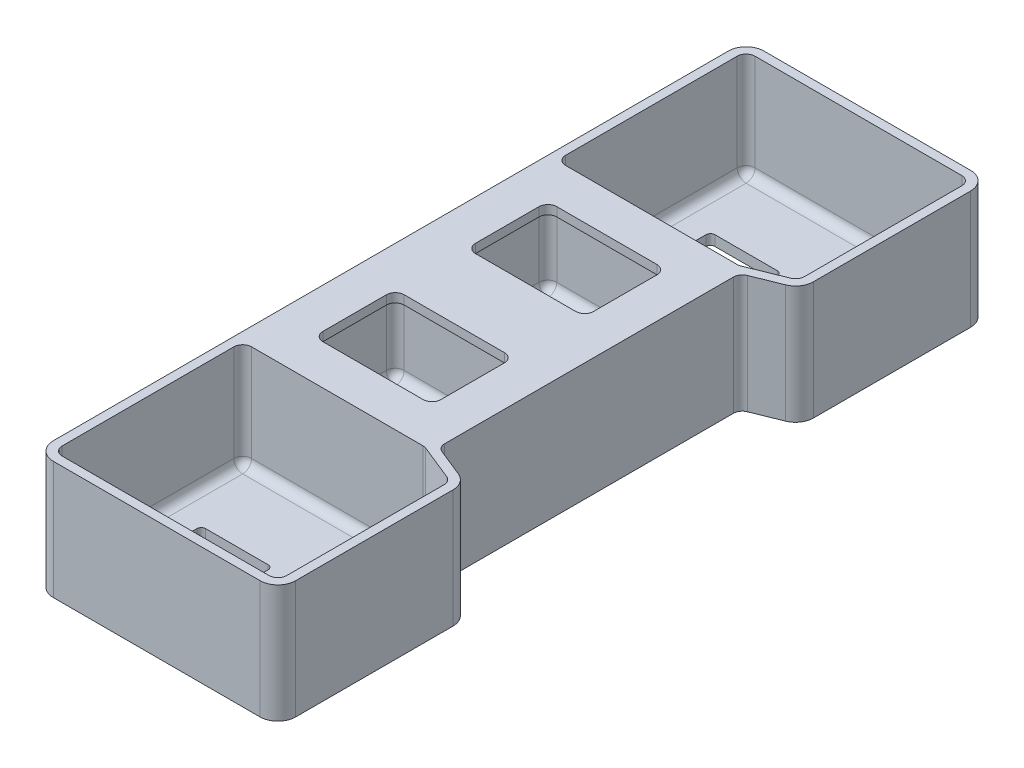
from build123d import *

# Parameters (mm, degrees)
EXTRUDE_1_DEPTH               = 265
EXTRUDE_2_REACH               = 1707.927
CUT_EXTRUDE_1_DEPTH           = 265
CUT_EXTRUDE_2_DEPTH           = 23
SKETCH_5_R                    = 77.00000000000003
CUT_EXTRUDE_3_DEPTH           = 3
SKETCH_6_R                    = 77.00000000000003
CUT_EXTRUDE_4_DEPTH           = 23
EXTRUDE_3_REACH               = 1301.485
SKETCH_7_W                    = 428.7372673266602
SKETCH_7_H                    = 19.99999999999997
CUT_EXTRUDE_5_DEPTH           = 20
HOLE_WIZARD_M10_1_D           = 8.5
HOLE_WIZARD_M10_1_DEPTH       = 20
HOLE_WIZARD_M10_1_CSINK_D     = 10.05
HOLE_WIZARD_M10_1_CSINK_ANGLE = 90
HOLE_WIZARD_M10_1_TIP         = 2.5536576308671313
CUT_EXTRUDE_6_DEPTH           = 705
FILLET_1_R                    = 20
FILLET_2_R                    = 40
FILLET_3_R                    = 20
FILLET_4_R                    = 40
FILLET_5_R                    = 20
FILLET_6_R                    = 20
FILLET_7_R                    = 20
FILLET_8_R                    = 20


with BuildPart() as part:
    # 草图1 → 凸台-拉伸1 (new body)
    with BuildSketch(Plane(origin=(0, 0, 0), x_dir=(1, 0, 0), z_dir=(0, 1, 0))):
        Polygon((0, -797.5000000000001), (0, 797.5000000000001), (544, 797.5000000000001), (544.0000000000001, 377.5000000000001), (444.99999999999994, 337.49999999999994), (444.99999999999994, -337.49999999999994), (544.0000000000001, -377.5000000000001), (544, -797.5000000000001), align=None)
        Polygon((20.000000000000036, 10), (425, 10), (425, 332.4999999999999), (20.000000000000018, 332.49999999999983), align=None, mode=Mode.SUBTRACT)
        Polygon((20.000000000000018, 777.4999999999999), (20.000000000000053, 352.49999999999994), (428.7372673266602, 352.49999999999994), (524, 390.9899929993293), (524, 777.5000000000001), align=None, mode=Mode.SUBTRACT)
        Polygon((524, -777.5000000000001), (20.000000000000018, -777.4999999999999), (20.000000000000053, -352.49999999999994), (428.7372673266602, -352.49999999999994), (524, -390.9899929993293), align=None, mode=Mode.SUBTRACT)
        Polygon((20.000000000000018, -332.49999999999983), (20.000000000000036, -10), (425, -10), (425, -332.4999999999999), align=None, mode=Mode.SUBTRACT)
    extrude(amount=EXTRUDE_1_DEPTH)

    # 凸台-拉伸2: up to this face of the body (flat: up to its plane)
    extrude_2_end = Plane(part.part.faces().sort_by_distance((272, 132.5, 797.5))[0])
    # 草图2 → 凸台-拉伸2 (add, up to the picked face)
    with BuildSketch(Plane(origin=(0, 0, -797.5000000000001), x_dir=(-1, 0, 0), z_dir=(0, 0, -1)), mode=Mode.PRIVATE) as extrude_2_sk1:
        Polygon((-544, 27.999999999999943), (0, 27.999999999999936), (0, 5.000000000000004), (-544, 4.9999999999999485), align=None)
    extrude_2_tool1 = split(extrude(extrude_2_sk1.sketch, amount=-EXTRUDE_2_REACH, mode=Mode.PRIVATE), bisect_by=extrude_2_end, keep=Keep.BOTH, mode=Mode.PRIVATE)
    add(extrude_2_tool1.solids().sort_by(Axis((272, 16.5, -797.5), (0, 0, 1)))[0])

    # 草图3 → 切除-拉伸1 (cut)
    with BuildSketch(Plane(origin=(-3.6e-16, 27.999999999999936, 0), x_dir=(1, 1e-17, 0), z_dir=(-1e-17, 1, 0))):
        Polygon((544, -377.5000000000003), (544.0000000000001, 377.5000000000001), (444.99999999999994, 337.49999999999994), (444.99999999999994, -337.49999999999994), align=None)
    extrude(amount=-CUT_EXTRUDE_1_DEPTH, mode=Mode.SUBTRACT)

    # 草图4 → 切除-拉伸2 (cut)
    with BuildSketch(Plane(origin=(-3.6e-16, 27.999999999999936, 0), x_dir=(1, 1e-17, 0), z_dir=(-1e-17, 1, 0))):
        with BuildLine():
            Line((95.00000000000003, 612.4999999999999), (95.00000000000003, 530.5000000000002))
            ThreePointArc((95.00000000000003, 530.5000000000002), (97.92893218813454, 523.4289321881347), (105.0000000000001, 520.5000000000001))
            Line((105.0000000000001, 520.5000000000001), (244.99999999999994, 520.5000000000001))
            ThreePointArc((244.99999999999994, 520.5000000000001), (252.0710678118655, 523.4289321881347), (255, 530.5000000000002))
            Line((255, 530.5000000000002), (255, 612.4999999999999))
            ThreePointArc((255, 612.4999999999999), (252.0710678118655, 619.5710678118654), (244.99999999999994, 622.5))
            Line((244.99999999999994, 622.5), (105.0000000000001, 622.5))
            ThreePointArc((105.0000000000001, 622.5), (97.92893218813454, 619.5710678118654), (95.00000000000003, 612.4999999999999))
        make_face()
        with BuildLine():
            Line((95.00000000000003, -612.4999999999999), (95.00000000000003, -530.5000000000002))
            ThreePointArc((95.00000000000003, -530.5000000000002), (97.92893218813454, -523.4289321881347), (105.0000000000001, -520.5000000000001))
            Line((105.0000000000001, -520.5000000000001), (244.99999999999994, -520.5000000000001))
            ThreePointArc((244.99999999999994, -520.5000000000001), (252.0710678118655, -523.4289321881347), (255, -530.5000000000002))
            Line((255, -530.5000000000002), (255, -612.4999999999999))
            ThreePointArc((255, -612.4999999999999), (252.0710678118655, -619.5710678118654), (244.99999999999994, -622.5))
            Line((244.99999999999994, -622.5), (105.0000000000001, -622.5))
            ThreePointArc((105.0000000000001, -622.5), (97.92893218813454, -619.5710678118654), (95.00000000000003, -612.4999999999999))
        make_face()
    extrude(amount=-CUT_EXTRUDE_2_DEPTH, mode=Mode.SUBTRACT)

    # 草图5 → 切除-拉伸3 (cut)
    # profile 1 of 2: a face of its own
    with BuildSketch(Plane(origin=(-3.6e-16, 27.999999999999936, 0), x_dir=(1, 1e-17, 0), z_dir=(-1e-17, 1, 0))):
        with BuildLine():
            Line((292.00000000000006, 704.5000000000001), (292.00000000000006, 450.50000000000017))
            ThreePointArc((292.00000000000006, 450.50000000000017), (294.3431457505077, 444.84314575050774), (300.0000000000001, 442.5000000000001))
            Line((300.0000000000001, 442.5000000000001), (487.99999999999994, 442.5000000000001))
            ThreePointArc((487.99999999999994, 442.5000000000001), (493.65685424949237, 444.84314575050774), (496, 450.50000000000017))
            Line((496, 450.50000000000017), (496, 704.5000000000002))
            ThreePointArc((496, 704.5000000000002), (493.65685424949237, 710.1568542494927), (487.99999999999994, 712.5000000000002))
            Line((487.99999999999994, 712.5000000000002), (300.0000000000001, 712.5000000000001))
            ThreePointArc((300.0000000000001, 712.5000000000001), (294.3431457505077, 710.1568542494925), (292.00000000000006, 704.5000000000001))
        make_face()
        with Locations(Location((394, 577.5000000000001, 0), (0, 0, 180))):
            Circle(SKETCH_5_R, mode=Mode.SUBTRACT)
    # profile 2 of 2: a face of its own
    with BuildSketch(Plane(origin=(-3.6e-16, 27.999999999999936, 0), x_dir=(1, 1e-17, 0), z_dir=(-1e-17, 1, 0))):
        with BuildLine():
            Line((496, -450.50000000000017), (496, -704.5000000000002))
            ThreePointArc((496, -704.5000000000002), (493.65685424949237, -710.1568542494927), (487.99999999999994, -712.5000000000002))
            Line((487.99999999999994, -712.5000000000002), (300.0000000000001, -712.5000000000001))
            ThreePointArc((300.0000000000001, -712.5000000000001), (294.3431457505077, -710.1568542494925), (292.00000000000006, -704.5000000000001))
            Line((292.00000000000006, -704.5000000000001), (292.00000000000006, -450.50000000000017))
            ThreePointArc((292.00000000000006, -450.50000000000017), (294.3431457505077, -444.84314575050774), (300.0000000000001, -442.5000000000001))
            Line((300.0000000000001, -442.5000000000001), (487.99999999999994, -442.5000000000001))
            ThreePointArc((487.99999999999994, -442.5000000000001), (493.65685424949237, -444.84314575050774), (496, -450.50000000000017))
        make_face()
        with Locations((394, -577.5000000000001)):
            Circle(SKETCH_5_R, mode=Mode.SUBTRACT)
    extrude(amount=-CUT_EXTRUDE_3_DEPTH, mode=Mode.SUBTRACT)

    # 草图6 → 切除-拉伸4 (cut)
    with BuildSketch(Plane(origin=(-3.6e-16, 27.999999999999936, 0), x_dir=(1, 1e-17, 0), z_dir=(-1e-17, 1, 0))):
        with Locations(Location((394, 577.5000000000001, 0), (0, 0, 180))):
            Circle(SKETCH_6_R)
        with Locations(Location((394, -577.5000000000001, 0), (0, 0, 180))):
            Circle(SKETCH_6_R)
    extrude(amount=-CUT_EXTRUDE_4_DEPTH, mode=Mode.SUBTRACT)

    # 凸台-拉伸3: up to this face of the body (flat: up to its plane)
    extrude_3_end = Plane(part.part.faces().sort_by_distance((222.5, 146.5, 332.5))[0])
    # 草图7 → 凸台-拉伸3 (add, up to the picked face)
    with BuildSketch(Plane(origin=(0, 0, -352.49999999999994), x_dir=(-1, 0, 0), z_dir=(0, 0, -1)), mode=Mode.PRIVATE) as extrude_3_sk1:
        with Locations((-214.3686336633301, 255)):
            Rectangle(SKETCH_7_W, SKETCH_7_H)
    extrude_3_tool1 = split(extrude(extrude_3_sk1.sketch, amount=-EXTRUDE_3_REACH, mode=Mode.PRIVATE), bisect_by=extrude_3_end, keep=Keep.BOTH, mode=Mode.PRIVATE)
    add(extrude_3_tool1.solids().sort_by(Axis((214.368634, 255, -352.5), (0, 0, 1)))[0])

    # 草图8 → 切除-拉伸5 (cut)
    with BuildSketch(Plane(origin=(0, 265, 0), x_dir=(1, 0, 0), z_dir=(0, 1, 0))):
        with BuildLine():
            Line((90.00000000000003, 242.49999999999983), (90.00000000000007, 100.0000000000001))
            ThreePointArc((90.00000000000007, 100.0000000000001), (95.8578643762691, 85.857864376269), (110.00000000000021, 79.99999999999996))
            Line((110.00000000000021, 79.99999999999996), (334.99999999999983, 80.00000000000001))
            ThreePointArc((334.99999999999983, 80.00000000000001), (349.1421356237309, 85.85786437626908), (355, 100.00000000000014))
            Line((355, 100.00000000000014), (355.00000000000006, 242.49999999999986))
            ThreePointArc((355.00000000000006, 242.49999999999986), (349.14213562373095, 256.64213562373095), (334.9999999999999, 262.5))
            Line((334.9999999999999, 262.5), (110.00000000000017, 262.49999999999994))
            ThreePointArc((110.00000000000017, 262.49999999999994), (95.8578643762691, 256.6421356237309), (90.00000000000003, 242.49999999999983))
        make_face()
        with BuildLine():
            Line((355, -100.00000000000014), (355.00000000000006, -242.49999999999986))
            ThreePointArc((355.00000000000006, -242.49999999999986), (349.14213562373095, -256.64213562373095), (334.9999999999999, -262.5))
            Line((334.9999999999999, -262.5), (110.00000000000017, -262.49999999999994))
            ThreePointArc((110.00000000000017, -262.49999999999994), (95.8578643762691, -256.6421356237309), (90.00000000000003, -242.49999999999983))
            Line((90.00000000000003, -242.49999999999983), (90.00000000000007, -100.0000000000001))
            ThreePointArc((90.00000000000007, -100.0000000000001), (95.8578643762691, -85.857864376269), (110.00000000000021, -79.99999999999996))
            Line((110.00000000000021, -79.99999999999996), (334.99999999999983, -80.00000000000001))
            ThreePointArc((334.99999999999983, -80.00000000000001), (349.1421356237309, -85.85786437626908), (355, -100.00000000000014))
        make_face()
    extrude(amount=-CUT_EXTRUDE_5_DEPTH, mode=Mode.SUBTRACT)

    # M10 螺纹孔1
    with Locations(Plane(origin=(-3.2e-16, 24.999999999999936, 0), x_dir=(1, 1e-17, 0), z_dir=(-1e-17, 1, 0))):
        with Locations((314, -692.5), (474, 692.5), (314, 692.5), (474, 462.5), (314, 462.5), (314, -462.5), (474, -462.5), (474, -692.5)):
            CounterSinkHole(HOLE_WIZARD_M10_1_D / 2, HOLE_WIZARD_M10_1_CSINK_D / 2, depth=HOLE_WIZARD_M10_1_DEPTH, counter_sink_angle=HOLE_WIZARD_M10_1_CSINK_ANGLE)
            with Locations((0, 0, -(HOLE_WIZARD_M10_1_DEPTH + HOLE_WIZARD_M10_1_TIP / 2))):  # 118° drill point
                Cone(0, HOLE_WIZARD_M10_1_D / 2, HOLE_WIZARD_M10_1_TIP, mode=Mode.SUBTRACT)

    # 草图11 → 切除-拉伸6 (cut)
    with BuildSketch(Plane(origin=(0, 0, -352.49999999999994), x_dir=(-1, 0, 0), z_dir=(0, 0, -1))):
        Polygon((-20.000000000000053, 0), (-428.7372673266602, 0), (-428.7372673266602, 4.9999999999999485), (-20.000000000000053, 5.000000000000004), align=None)
    extrude(amount=-CUT_EXTRUDE_6_DEPTH, mode=Mode.SUBTRACT)

    # 圆角1
    fillet_1_edges = [part.edges().sort_by_distance(p)[0] for p in [
        (444.99999999999994, 132.5, -337.49999999999994),
        (524, 146.49999999999997, -777.5000000000001),
        (20.000000000000018, 146.49999999999997, -777.4999999999999),
        (20.000000000000053, 146.49999999999997, -352.49999999999994),
        (428.7372673266602, 146.49999999999997, -352.49999999999994),
        (524, 146.49999999999997, -390.9899929993293),
    ]]
    fillet(fillet_1_edges, radius=FILLET_1_R)

    # 圆角2
    fillet_2_edges = [part.edges().sort_by_distance(p)[0] for p in [
        (0, 132.5, -797.5000000000001),
        (544, 132.5, -797.5000000000001),
        (544.0000000000001, 132.5, -377.5000000000001),
    ]]
    fillet(fillet_2_edges, radius=FILLET_2_R)

    # 圆角3
    fillet_3_edges = [part.edges().sort_by_distance(p)[0] for p in [
        (444.99999999999994, 132.5, 337.49999999999994),
        (524, 146.49999999999997, 777.5000000000001),
        (524, 146.49999999999997, 390.9899929993293),
        (428.7372673266602, 146.49999999999997, 352.49999999999994),
        (20.000000000000053, 146.49999999999997, 352.49999999999994),
        (20.000000000000018, 146.49999999999997, 777.4999999999999),
    ]]
    fillet(fillet_3_edges, radius=FILLET_3_R)

    # 圆角4
    fillet_4_edges = [part.edges().sort_by_distance(p)[0] for p in [
        (544.0000000000001, 132.5, 377.5000000000001),
        (544, 132.5, 797.5000000000001),
        (0, 132.5, 797.5000000000001),
    ]]
    fillet(fillet_4_edges, radius=FILLET_4_R)

    # 圆角5
    fillet_5_edges = [part.edges().sort_by_distance(p)[0] for p in [
        (20.000000000000036, 136.49999999999997, 10),
        (20.000000000000018, 136.49999999999997, 332.49999999999983),
        (425, 136.5, 10),
        (425, 136.5, 332.4999999999999),
        (425, 136.5, -332.4999999999999),
        (20.000000000000018, 136.49999999999997, -332.49999999999983),
        (425, 136.5, -10),
        (20.000000000000036, 136.49999999999997, -10),
    ]]
    fillet(fillet_5_edges, radius=FILLET_5_R)

    # 圆角6
    fillet_6_edges = [part.edges().sort_by_distance(p)[0] for p in [
        (20.000000000000025, 27.999999999999936, -564.9999999999999),
        (524, 27.999999999999943, -580.9899929993293),
        (272, 27.99999999999994, -777.5),
        (232.42476732666017, 27.99999999999994, -352.49999999999994),
        (471.9171252143318, 27.999999999999943, -369.94640722734204),
        (25.857864376269035, 27.999999999999936, -771.6421356237308),
        (518.142135623731, 27.999999999999943, -771.6421356237311),
        (520.5808196081109, 27.999999999999943, -393.29622897683066),
        (428.6658342065693, 27.999999999999943, -352.86747958819666),
        (25.8578643762691, 27.999999999999943, -358.357864376269),
        (272, 27.99999999999994, 777.5),
        (524, 27.999999999999943, 580.9899929993293),
        (471.91712521433186, 27.999999999999943, 369.946407227342),
        (232.42476732666017, 27.99999999999994, 352.4999999999999),
        (20.00000000000007, 27.999999999999936, 564.9999999999999),
        (25.857864376269035, 27.999999999999936, 771.6421356237308),
        (25.857864376269127, 27.999999999999936, 358.357864376269),
        (520.5808196081109, 27.999999999999943, 393.2962289768306),
        (428.6658342065693, 27.999999999999943, 352.86747958819666),
        (518.142135623731, 27.999999999999943, 771.6421356237311),
        (222.50000000000006, 27.99999999999994, 332.49999999999983),
        (19.999999999999986, 27.999999999999936, 171.24999999999991),
        (425, 27.999999999999943, 171.24999999999994),
        (222.5, 27.99999999999994, 10),
        (419.14213562373095, 27.99999999999994, 15.857864376269047),
        (25.857864376269074, 27.999999999999936, 15.857864376269049),
        (25.857864376269113, 27.999999999999936, 326.6421356237308),
        (419.14213562373095, 27.99999999999994, 326.64213562373084),
        (20.00000000000003, 27.999999999999936, -171.2499999999999),
        (222.50000000000006, 27.99999999999994, -332.49999999999983),
        (222.5, 27.99999999999994, -10),
        (425, 27.999999999999943, -171.24999999999994),
        (419.14213562373095, 27.99999999999994, -326.64213562373084),
        (419.14213562373095, 27.99999999999994, -15.857864376269047),
        (25.85786437626909, 27.999999999999936, -326.6421356237308),
        (25.85786437626907, 27.999999999999936, -15.857864376269053),
    ]]
    fillet(fillet_6_edges, radius=FILLET_6_R)

    # 圆角7
    fillet_7_edges = [part.edges().sort_by_distance(p)[0] for p in [
        (428.7372673266602, 2.49999999999998, 352.49999999999994),
        (524, 2.499999999999975, 390.9899929993293),
        (524, 2.499999999999975, -390.9899929993293),
        (524, 2.499999999999975, -777.5000000000001),
        (428.7372673266602, 2.49999999999998, -352.49999999999994),
        (20.000000000000018, 2.5000000000000013, -777.4999999999999),
        (20.000000000000018, 2.5000000000000013, 777.4999999999999),
        (524, 2.499999999999975, 777.5000000000001),
    ]]
    fillet(fillet_7_edges, radius=FILLET_7_R)

    # 圆角8
    fillet_8_edges = [part.edges().sort_by_distance(p)[0] for p in [
        (222.50000000000003, 245.00000000000003, 332.4999999999999),
        (425, 245.00000000000003, 171.24999999999997),
        (222.5, 245.00000000000003, 10),
        (20.000000000000025, 245.00000000000003, 171.24999999999991),
        (419.14213562373095, 245.00000000000003, 15.857864376269047),
        (25.857864376269085, 245.00000000000003, 15.857864376269038),
        (25.85786437626909, 245.00000000000003, 326.6421356237308),
        (419.14213562373095, 245.00000000000003, 326.64213562373084),
        (20.000000000000046, 245.00000000000003, -171.24999999999991),
        (222.5, 245.00000000000003, -10),
        (222.50000000000003, 245.00000000000003, -332.49999999999983),
        (425, 245.00000000000003, -171.24999999999994),
        (419.14213562373095, 245.00000000000003, -326.64213562373084),
        (419.14213562373095, 245.00000000000003, -15.857864376269047),
        (25.85786437626909, 245.00000000000003, -326.6421356237308),
        (25.857864376269085, 245.00000000000003, -15.857864376269038),
    ]]
    fillet(fillet_8_edges, radius=FILLET_8_R)


solid = part.part
